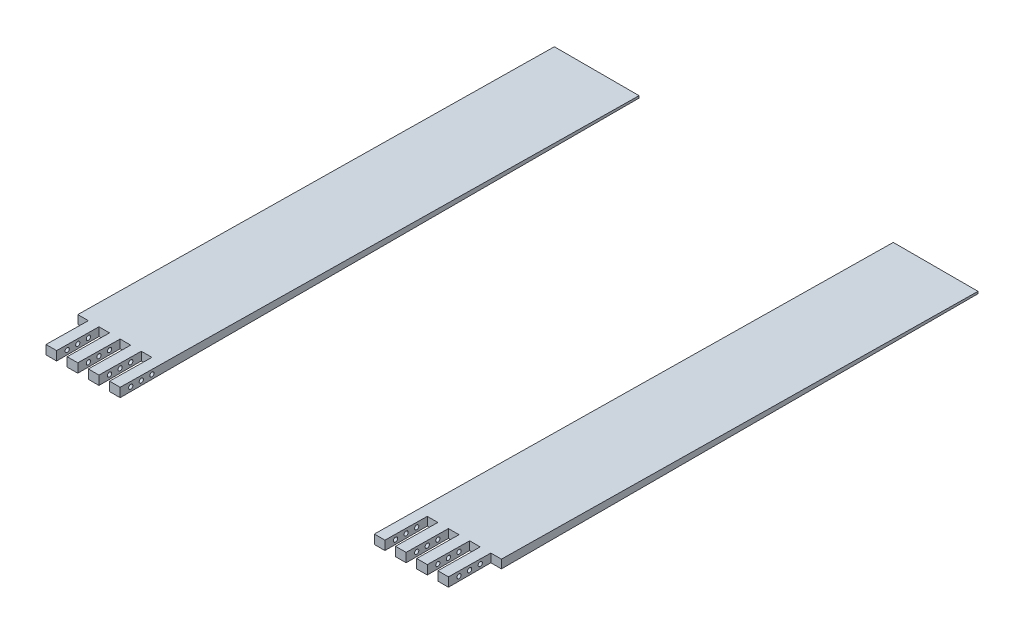
from build123d import *

# Parameters (mm, degrees)
SKETCH_1_W          = 40
SKETCH_1_H          = 435
SKETCH_1_H_2        = 40
SKETCH_1_W_2        = 120
EXTRUDE_1_DEPTH     = 5
CUT_EXTRUDE_2_DEPTH = 498.041245773
CUT_EXTRUDE_3_DEPTH = 466.886252212
SKETCH_4_R          = 1
CUT_EXTRUDE_4_DEPTH = 498.034409719


with BuildPart() as part:
    # 草图1 → 凸台-拉伸1 (new body)
    with BuildSketch(Plane(origin=(0, 0, 0), x_dir=(1, 0, 0), z_dir=(0, 1, 0))):
        with Locations((-80, 237.5)):
            Rectangle(SKETCH_1_W, SKETCH_1_H)
        with Locations((-80, 0)):
            Rectangle(SKETCH_1_W, SKETCH_1_H_2)
        Rectangle(SKETCH_1_W_2, SKETCH_1_H_2)
        with Locations((80, 0)):
            Rectangle(SKETCH_1_W, SKETCH_1_H_2)
        with Locations((80, 237.5)):
            Rectangle(SKETCH_1_W, SKETCH_1_H)
    extrude(amount=EXTRUDE_1_DEPTH)

    # 草图2 → 切除-拉伸2 (cut, through all)
    with BuildSketch(Plane(origin=(100, 0, 0), x_dir=(0, 0, -1), z_dir=(1, 0, 0))):
        Polygon((155, 5), (455, 1), (455, 5), align=None)
    extrude(amount=-CUT_EXTRUDE_2_DEPTH, mode=Mode.SUBTRACT)

    # 草图3 → 切除-拉伸3 (cut, through all)
    with BuildSketch(Plane(origin=(0, 5, 0), x_dir=(1, 0, 0), z_dir=(0, 1, 0))):
        Polygon((-60, 20), (-60, 155), (-100, 155), (-100, -20), (100, -20), (100, 155), (60, 155), (60, 20), align=None)
        Polygon((-100, 230), (-100, 155), (-60, 155), (-60, 20), (60, 20), (60, 155), (100, 155), (100, 230), (95, 230), (95, 210), (90, 210), (90, 230), (85, 230), (85, 210), (80, 210), (80, 230), (75, 230), (75, 210), (70, 210), (70, 230), (65, 230), (65, 210), (60, 210), (60, 230), (-60, 230), (-60, 210), (-65, 210), (-65, 230), (-70, 230), (-70, 210), (-75, 210), (-75, 230), (-80, 230), (-80, 210), (-85, 210), (-85, 230), (-90, 230), (-90, 210), (-95, 210), (-95, 230), align=None)
    extrude(amount=-CUT_EXTRUDE_3_DEPTH, mode=Mode.SUBTRACT)


with BuildPart() as cut_extrude_3_piece_1:
    # of the separate pieces the step leaves, piece 1, a body of its own (cut_extrude_3_pieces)
    add(part.part.solids().sort_by_distance((100, 0, -230))[0])


with BuildPart() as cut_extrude_3_piece_2:
    # of the separate pieces the step leaves, piece 2, a body of its own (cut_extrude_3_pieces)
    add(part.part.solids().sort_by_distance((-100, 0, -455))[0])


with BuildPart() as cut_extrude_4_tool:
    # 草图4 → 切除-拉伸4 (new, through all)
    with BuildSketch(Plane(origin=(100, 0, 0), x_dir=(0, 0, -1), z_dir=(1, 0, 0))):
        with Locations((225, 2)):
            Circle(SKETCH_4_R)
        with Locations((220, 2)):
            Circle(SKETCH_4_R)
        with Locations((215, 2)):
            Circle(SKETCH_4_R)
    extrude(amount=-CUT_EXTRUDE_4_DEPTH)


with BuildPart() as cut_extrude_3_piece_1_1:
    add(cut_extrude_3_piece_1.part)

    # 切除-拉伸4: cut by cut_extrude_4_tool
    add(cut_extrude_4_tool.part, mode=Mode.SUBTRACT)


with BuildPart() as cut_extrude_3_piece_2_1:
    add(cut_extrude_3_piece_2.part)

    # 切除-拉伸4: cut by cut_extrude_4_tool
    add(cut_extrude_4_tool.part, mode=Mode.SUBTRACT)


solid = Compound([cut_extrude_3_piece_1_1.part, cut_extrude_3_piece_2_1.part])
